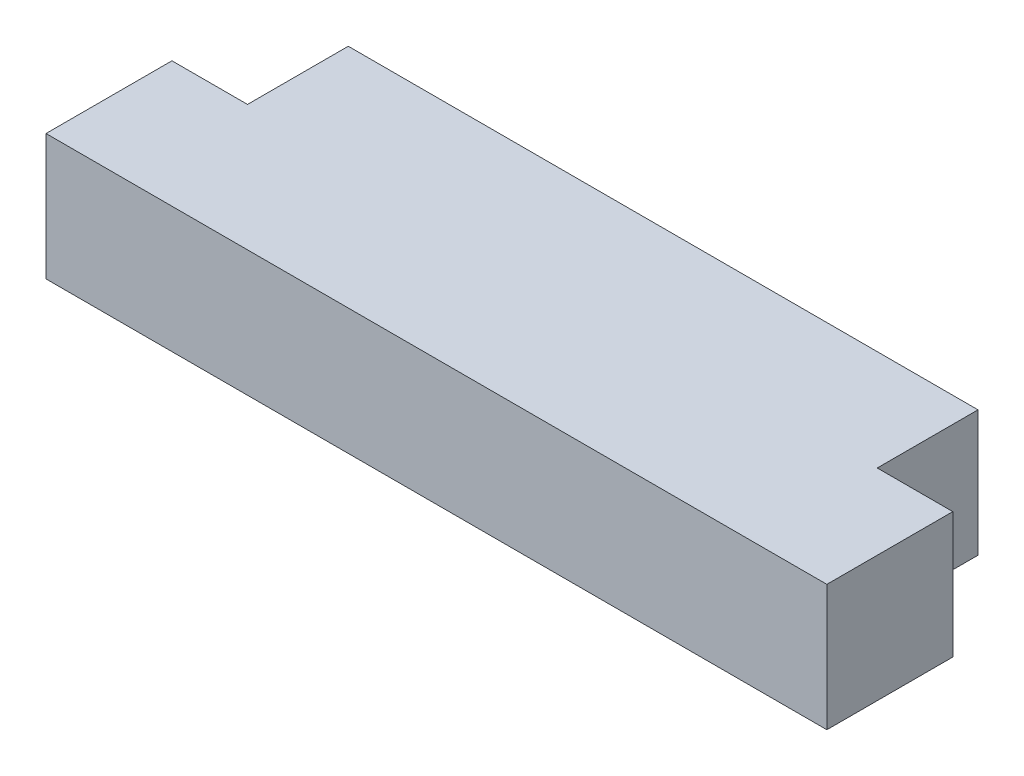
from build123d import *

# Parameters (mm, degrees)
BOSS_EXTRUDE1_DEPTH = 5


with BuildPart() as part:
    # Sketch1 → Boss-Extrude1 (new body)
    with BuildSketch(Plane(origin=(0, 0, 0), x_dir=(1, 0, 0), z_dir=(0, 1, 0))):
        Polygon((0, 0), (0, 5), (3, 5), (3, 9), (28, 9), (28, 5), (31, 5), (31, 0), align=None)
    extrude(amount=BOSS_EXTRUDE1_DEPTH)


solid = part.part
